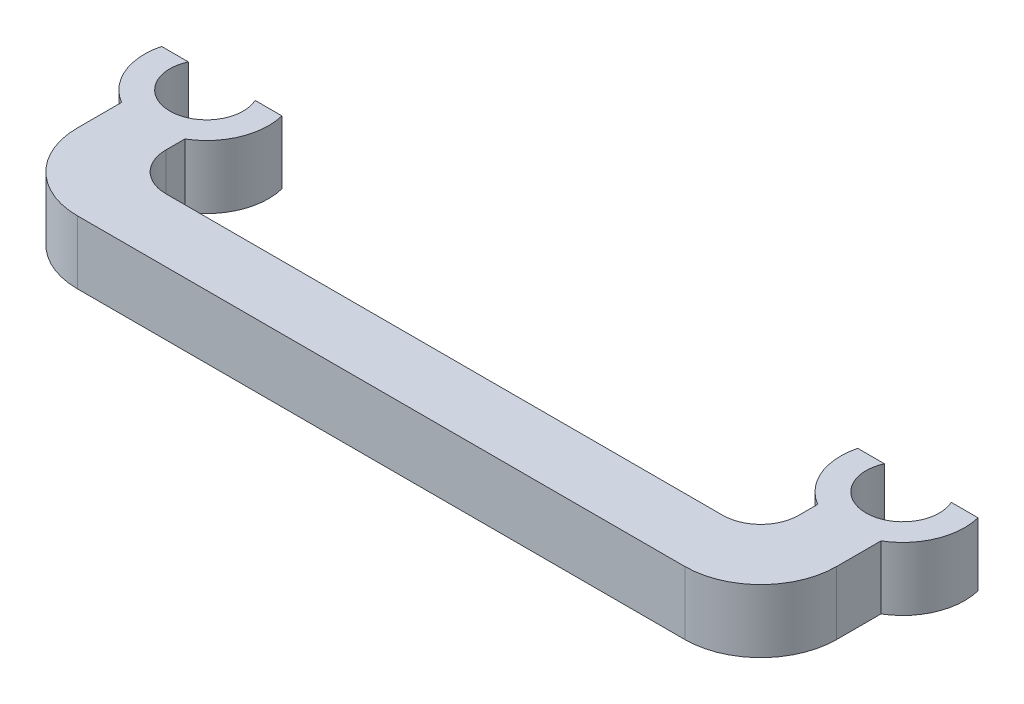
from build123d import *

# Parameters (mm, degrees)
BOSS_EXTRUDE1_DEPTH = 5
FILLET1_R           = 3
FILLET2_R           = 6


with BuildPart() as part:
    # Sketch2 → Boss-Extrude1 (new body)
    with BuildSketch(Plane(origin=(0, 0, 0), x_dir=(1, 0, 0), z_dir=(0, 1, 0))):
        with BuildLine():
            ThreePointArc((-32.250789408, 12.414261501), (-27.5, 6.314261501), (-22.749210592, 12.414261501))
            Line((-22.749210592, 12.414261501), (-24.859924244, 12.414261501))
            ThreePointArc((-24.859924244, 12.414261501), (-27.5, 8.314261501), (-30.140075756, 12.414261501))
            Line((-30.140075756, 12.414261501), (-32.250789408, 12.414261501))
        make_face()
        with BuildLine():
            Line((25, 7), (25, 2.5))
            Line((25, 2.5), (-25, 2.5))
            Line((-25, 2.5), (-25, 7))
            ThreePointArc((-25, 7), (-27.5, 6.314261501), (-30, 7))
            Line((-30, 7), (-30, -2.5))
            Line((-30, -2.5), (30, -2.5))
            Line((30, -2.5), (30, 7))
            ThreePointArc((30, 7), (27.5, 6.314261501), (25, 7))
        make_face()
        with BuildLine():
            Line((30.140075756, 12.414261501), (32.250789408, 12.414261501))
            ThreePointArc((32.250789408, 12.414261501), (27.5, 6.314261501), (22.749210592, 12.414261501))
            Line((22.749210592, 12.414261501), (24.859924244, 12.414261501))
            ThreePointArc((24.859924244, 12.414261501), (27.5, 8.314261501), (30.140075756, 12.414261501))
        make_face()
    extrude(amount=BOSS_EXTRUDE1_DEPTH)

    # Fillet1
    fillet1_edges = [part.edges().sort_by_distance(p)[0] for p in [
        (-25, 2.5, -2.5),
        (25, 2.5, -2.5),
    ]]
    fillet(fillet1_edges, radius=FILLET1_R)

    # Fillet2
    fillet2_edges = [part.edges().sort_by_distance(p)[0] for p in [
        (30, 2.5, 2.5),
        (-30, 2.5, 2.5),
    ]]
    fillet(fillet2_edges, radius=FILLET2_R)


solid = part.part
